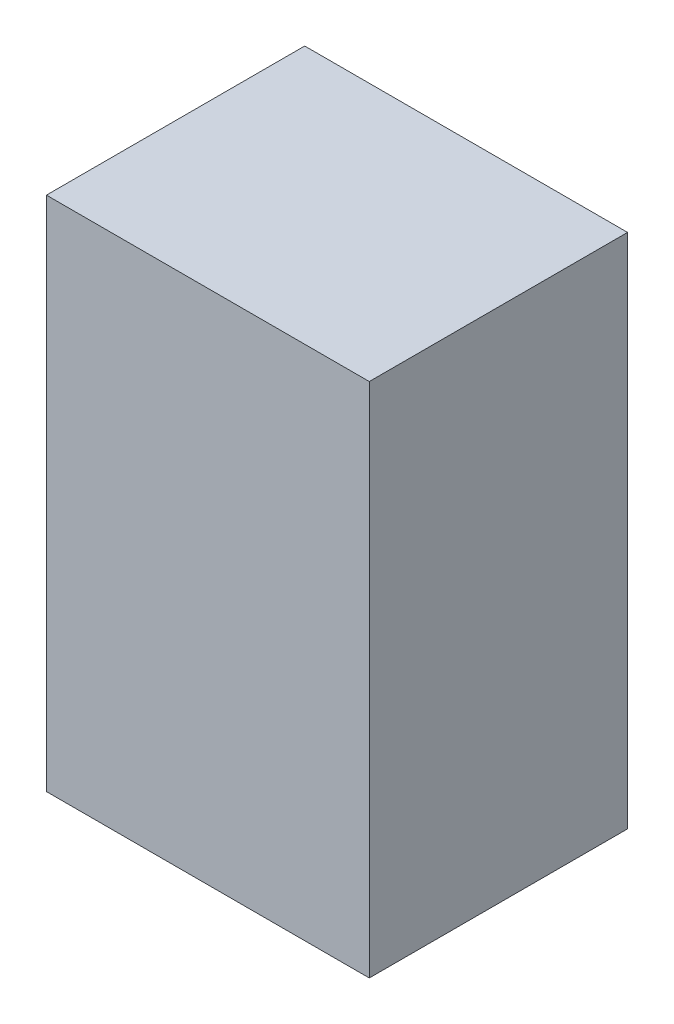
from build123d import *

# Parameters (mm, degrees)
SKETCH1_W           = 80
SKETCH1_H           = 40
BOSS_EXTRUDE1_DEPTH = 50


with BuildPart() as part:
    # Sketch1 → Boss-Extrude1 (new body)
    with BuildSketch(Plane.YZ):
        Rectangle(SKETCH1_W, SKETCH1_H)
    extrude(amount=BOSS_EXTRUDE1_DEPTH)


solid = part.part
